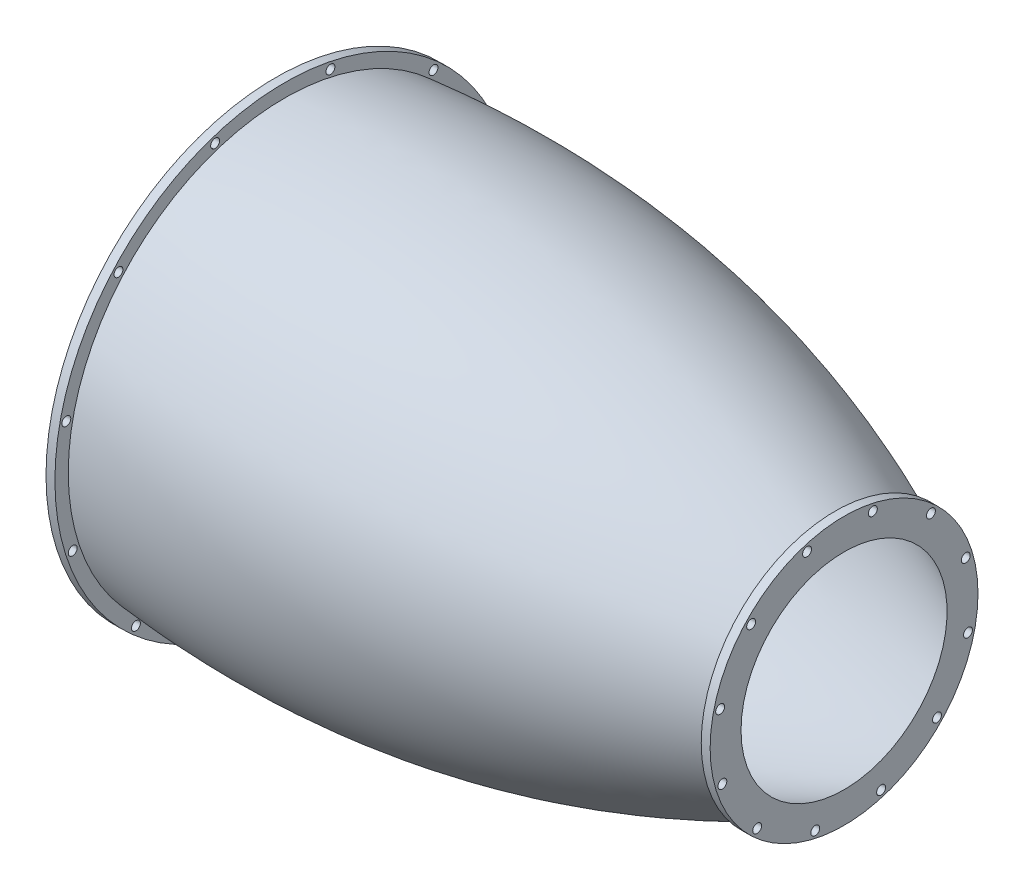
from build123d import *

# Parameters (mm, degrees)
SKETCH4_W           = 2299.140163329
SKETCH4_H           = 1084.867048291
CUT_EXTRUDE1_DEPTH  = 782.066
SKETCH5_R           = 95.504801646
SKETCH5_R_2         = 82.804801646
BOSS_EXTRUDE1_DEPTH = 6.35
SKETCH6_R           = 163.859870936
SKETCH6_R_2         = 153.699870936
BOSS_EXTRUDE2_DEPTH = 6.35
CIRPATTERN1_COUNT   = 12
CIRPATTERN2_COUNT   = 12


with BuildPart() as part:
    # Sketch1 → Revolve3 (revolve)
    with BuildSketch(Plane.XY):
        with BuildLine():
            add(Edge.make_bspline(
                [(0, 78.994), (170.262088596, 327.756991404), (500, 339.09)],
                knots=[0, 0, 0, 1, 1, 1], degree=2))
            Line((500, 339.09), (500, 330.2))
            add(Edge.make_bspline(
                [(0, 70.104), (170.262088596, 318.866991404), (500, 330.2)],
                knots=[0, 0, 0, 1, 1, 1], degree=2))
            add(Edge.make_bspline(
                [(0, 70.104), (-195.449728047, 157.410787998), (-412.824178468, 144.809870936)],
                knots=[0, 0, 0, 1, 1, 1], degree=2))
            Line((-412.824178468, 144.809870936), (-412.824178468, 153.699870936))
            add(Edge.make_bspline(
                [(0, 78.994), (-192.730394607, 176.706088879), (-412.824178468, 153.699870936)],
                knots=[0, 0, 0, 1, 1, 1], degree=2))
        make_face()
    revolve(axis=Axis((-1229.828239288, 0, 0), (1, 0, 0)))

    # Sketch4 → Cut-Extrude1 (cut)
    with BuildSketch(Plane.ZY.offset(7.62)):
        with Locations((-63.658537287, 96.480710784)):
            Rectangle(SKETCH4_W, SKETCH4_H)
    extrude(amount=-CUT_EXTRUDE1_DEPTH, mode=Mode.SUBTRACT)

    # Sketch5 → Boss-Extrude1 (add)
    with BuildSketch(Plane(origin=(-7.62, 0, 0), x_dir=(0, 0, -1), z_dir=(1, 0, 0))):
        Circle(SKETCH5_R)
        Circle(SKETCH5_R_2, mode=Mode.SUBTRACT)
    extrude(amount=-BOSS_EXTRUDE1_DEPTH)

    # Sketch6 → Boss-Extrude2 (add)
    with BuildSketch(Plane.ZY.offset(412.824178468)):
        Circle(SKETCH6_R)
        Circle(SKETCH6_R_2, mode=Mode.SUBTRACT)
    extrude(amount=-BOSS_EXTRUDE2_DEPTH)

    # Sketch8 → 1/4 (0.25) Diameter Hole1 (revolve, cut)
    with BuildSketch(Plane(origin=(-13.97, -88.351509107, 20.518383176), x_dir=(0, 0, 1), z_dir=(0, 1, 0))):
        Polygon((0, 0), (0, 8.257732465), (3.175, 6.35), (3.175, 0), align=None)
    f_1_4_0_25_diameter_hole1 = revolve(axis=Axis((-20.32, -88.351509107, 20.518383176), (1, 0, 0)), mode=Mode.SUBTRACT)

    # CirPattern1: 1/4 (0.25) Diameter Hole1 ×12 about axis
    cirpattern1_axis = Axis((0, 0, 0), (1, 0, 0))
    for i in range(1, CIRPATTERN1_COUNT):
        add(f_1_4_0_25_diameter_hole1.rotate(cirpattern1_axis, i * 360 / CIRPATTERN1_COUNT), mode=Mode.SUBTRACT)

    # Sketch10 → 1/4 (0.25) Diameter Hole2 (revolve, cut)
    with BuildSketch(Plane(origin=(-406.474178468, -155.721669204, 32.609841658), x_dir=(0, 0, -1), z_dir=(0, 1, 0))):
        Polygon((0, 0), (0, 8.257732465), (3.175, 6.35), (3.175, 0), align=None)
    f_1_4_0_25_diameter_hole2 = revolve(axis=Axis((-400.124178468, -155.721669204, 32.609841658), (-1, 0, 0)), mode=Mode.SUBTRACT)

    # CirPattern2: 1/4 (0.25) Diameter Hole2 ×12 about axis
    cirpattern2_axis = Axis((0, 0, 0), (1, 0, 0))
    for i in range(1, CIRPATTERN2_COUNT):
        add(f_1_4_0_25_diameter_hole2.rotate(cirpattern2_axis, i * 360 / CIRPATTERN2_COUNT), mode=Mode.SUBTRACT)


solid = part.part
